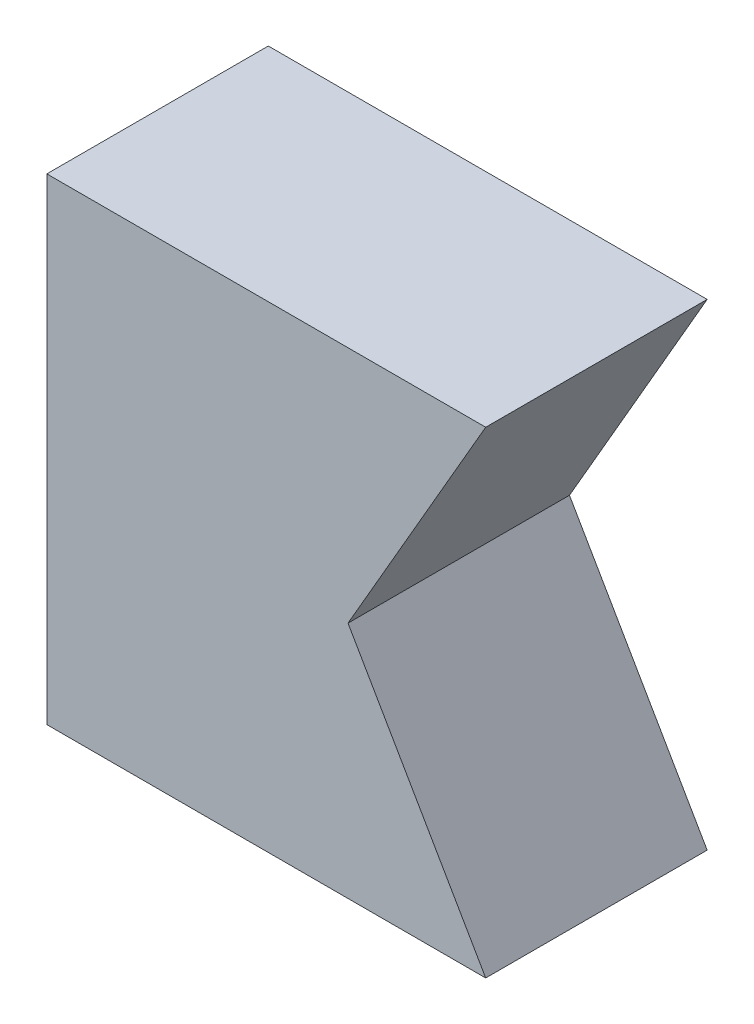
from build123d import *

# Parameters (mm, degrees)
CROQUIS1_R                 = 1.5
SALIENTE_EXTRUIR1_DEPTH    = 7
CORTAR_EXTRUIR1_DEPTH      = 10
CORTAR_EXTRUIR1_DEPTH_BACK = 27.438608133
CROQUIS2_R                 = 1.5
CORTAR_EXTRUIR2_DEPTH      = 27.438608133
CORTAR_EXTRUIR2_DEPTH_BACK = 27.438608133
CROQUIS3_W                 = 6
CROQUIS3_H                 = 7
CORTAR_EXTRUIR3_DEPTH      = 1.5
CROQUIS5_OUTSIDE_W         = 50.708
CROQUIS5_OUTSIDE_H         = 20.708
CROQUIS5_OUTSIDE_W_2       = 3
CROQUIS5_OUTSIDE_H_2       = 6
CORTAR_EXTRUIR4_DEPTH      = 27.438608133
CROQUIS6_OUTSIDE_W         = 6.706
CROQUIS6_OUTSIDE_H         = 9.706
CROQUIS6_OUTSIDE_W_2       = 2.6
CROQUIS6_OUTSIDE_H_2       = 5.6
CORTAR_EXTRUIR5_DEPTH      = 7.245101176


with BuildPart() as part:
    # Croquis1 → Saliente-Extruir1 (new, symmetric)
    with BuildSketch(Plane(origin=(0, 0, 0), x_dir=(0, 0, -1), z_dir=(1, 0, 0))):
        with BuildLine():
            Line((-24, 5), (15, 5))
            Line((15, 5), (15, -5))
            Line((15, -5), (-24, -5))
            ThreePointArc((-24, -5), (-24.707106781, -4.707106781), (-25, -4))
            Line((-25, -4), (-25, 4))
            ThreePointArc((-25, 4), (-24.707106781, 4.707106781), (-24, 5))
        make_face()
        with Locations((-22, 0)):
            Circle(CROQUIS1_R, mode=Mode.SUBTRACT)
    extrude(amount=SALIENTE_EXTRUIR1_DEPTH, both=True)

    # Croquis2 → Cortar-Extruir1 (cut, two sides: drawn at the far end of the back side and taken through both)
    with BuildSketch(Plane.XY.offset(-CORTAR_EXTRUIR1_DEPTH_BACK)):
        Circle(CROQUIS2_R)
    extrude(amount=CORTAR_EXTRUIR1_DEPTH + CORTAR_EXTRUIR1_DEPTH_BACK, mode=Mode.SUBTRACT)

    # Croquis3 → Cortar-Extruir2 (cut, two sides: drawn at the far end of the back side and taken through both)
    with BuildSketch(Plane(origin=(0, 0, 0), x_dir=(1, 0, 0), z_dir=(0, 1, 0)).offset(-CORTAR_EXTRUIR2_DEPTH_BACK)):
        with Locations((0, -21.5)):
            Rectangle(CROQUIS3_W, CROQUIS3_H)
    extrude(amount=CORTAR_EXTRUIR2_DEPTH + CORTAR_EXTRUIR2_DEPTH_BACK, mode=Mode.SUBTRACT)

    # Croquis4 → Cortar-Extruir3 (cut, symmetric)
    with BuildSketch(Plane.XY):
        Polygon((1.732050808, 3), (-1.732050808, 3), (-3.464101615, 0), (-1.732050808, -3), (1.732050808, -3), (3.464101615, 0), align=None)
    extrude(amount=CORTAR_EXTRUIR3_DEPTH, both=True, mode=Mode.SUBTRACT)

    # Croquis5 outside → Cortar-Extruir4 (cut, through all)
    with BuildSketch(Plane(origin=(0, 0, 0), x_dir=(0, 0, -1), z_dir=(1, 0, 0))):
        with Locations((-5, 0)):
            Rectangle(CROQUIS5_OUTSIDE_W, CROQUIS5_OUTSIDE_H)
        Rectangle(CROQUIS5_OUTSIDE_W_2, CROQUIS5_OUTSIDE_H_2, mode=Mode.SUBTRACT)
    extrude(amount=-CORTAR_EXTRUIR4_DEPTH, mode=Mode.SUBTRACT)


with BuildPart() as body_2:
    # of the pieces the cut leaves, the one that is kept (cortar_extruir4_keep)
    add(part.part.solids().sort_by_distance((-7, 3, -1.5))[0])

    # Croquis6 outside → Cortar-Extruir5 (cut, through all)
    with BuildSketch(Plane.ZY.offset(7)):
        Rectangle(CROQUIS6_OUTSIDE_W, CROQUIS6_OUTSIDE_H)
        Rectangle(CROQUIS6_OUTSIDE_W_2, CROQUIS6_OUTSIDE_H_2, mode=Mode.SUBTRACT)
    extrude(amount=-CORTAR_EXTRUIR5_DEPTH, mode=Mode.SUBTRACT)


solid = body_2.part
